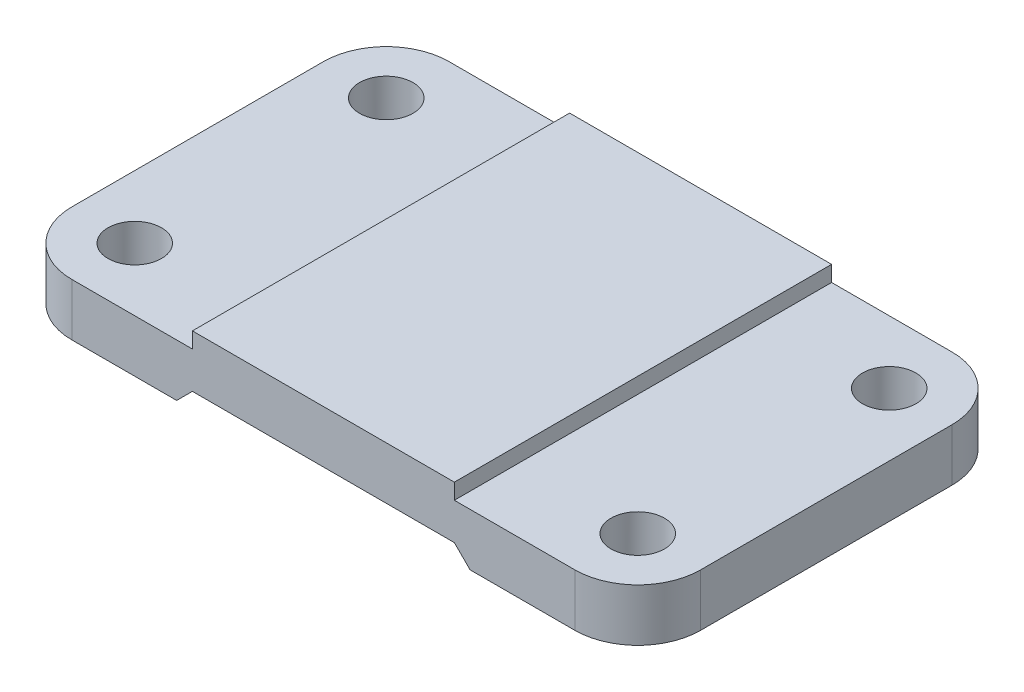
from build123d import *

# Parameters (mm, degrees)
SKETCH1_W           = 50
SKETCH1_H           = 72
BOSS_EXTRUDE1_DEPTH = 10
BOSS_EXTRUDE2_DEPTH = 36
SKETCH4_R           = 5.1
CUT_EXTRUDE1_DEPTH  = 36
FILLET1_R           = 12
FILLET2_R           = 12
FILLET3_R           = 12


with BuildPart() as part:
    # Sketch1 → Boss-Extrude1 (new body)
    with BuildSketch(Plane(origin=(0, 0, 0), x_dir=(1, 0, 0), z_dir=(0, 1, 0))):
        Rectangle(SKETCH1_W, SKETCH1_H)
    extrude(amount=BOSS_EXTRUDE1_DEPTH)

    # Sketch3 → Boss-Extrude2 (add, symmetric)
    with BuildSketch(Plane.XY):
        Polygon((-25, 7), (-60, 7), (-60, -3), (-28, -3), (-25, 0), align=None)
        Polygon((25, 7), (60, 7), (60, -3), (28, -3), (25, 0), align=None)
    extrude(amount=BOSS_EXTRUDE2_DEPTH, both=True)

    # Sketch4 → Cut-Extrude1 (cut, symmetric)
    with BuildSketch(Plane(origin=(0, 0, 0), x_dir=(1, 0, 0), z_dir=(0, 1, 0))):
        with Locations(Location((-48, 24, 0), (0, 0, 180))):
            Circle(SKETCH4_R)
        with Locations(Location((-48, -24, 0), (0, 0, 180))):
            Circle(SKETCH4_R)
        with Locations((48, 24)):
            Circle(SKETCH4_R)
        with Locations((48, -24)):
            Circle(SKETCH4_R)
    extrude(amount=CUT_EXTRUDE1_DEPTH, both=True, mode=Mode.SUBTRACT)

    # Fillet1
    fillet1_edges = [part.edges().sort_by_distance(p)[0] for p in [
        (-60, 2, -36),
    ]]
    fillet(fillet1_edges, radius=FILLET1_R)

    # Fillet2
    fillet2_edges = [part.edges().sort_by_distance(p)[0] for p in [
        (-60, 2, 36),
    ]]
    fillet(fillet2_edges, radius=FILLET2_R)

    # Fillet3
    fillet3_edges = [part.edges().sort_by_distance(p)[0] for p in [
        (60, 2, -36),
        (60, 2, 36),
    ]]
    fillet(fillet3_edges, radius=FILLET3_R)


solid = part.part
